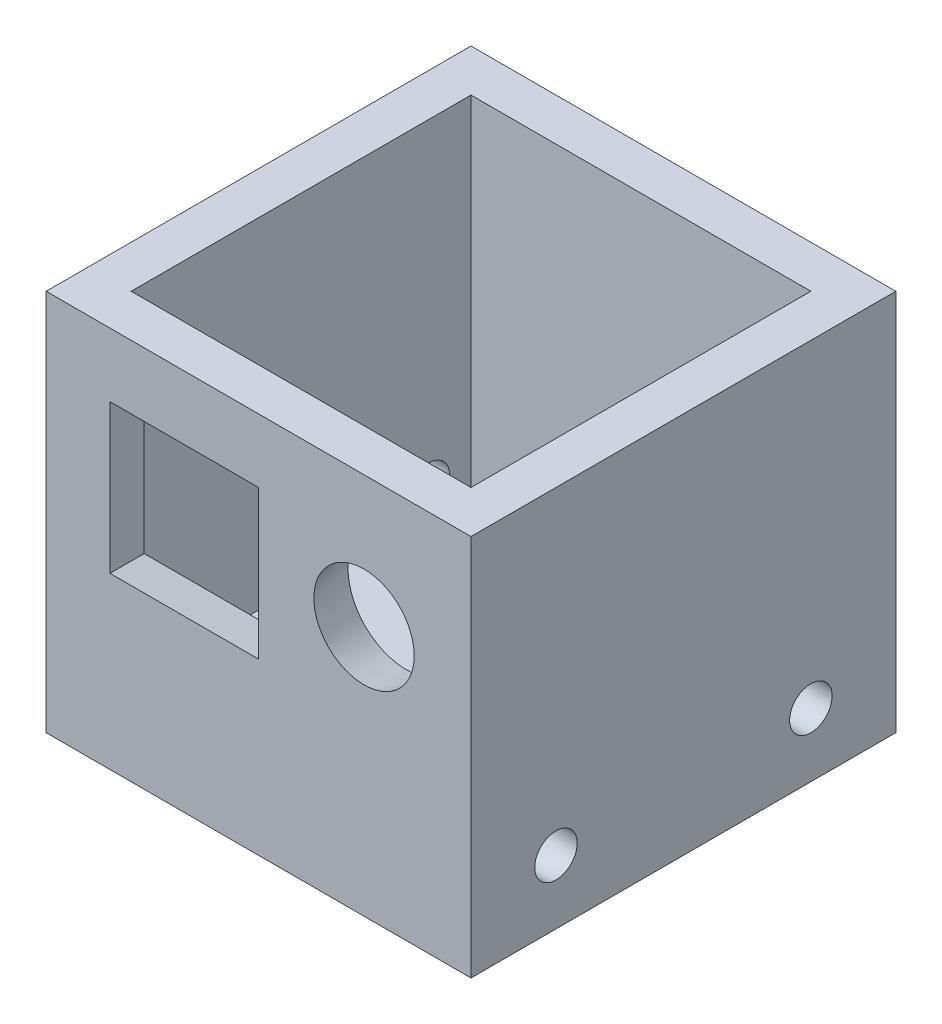
from build123d import *

# Parameters (mm, degrees)
ESQUISSE1_W                       = 10
ESQUISSE1_H                       = 10
BOSS_EXTRU_1_DEPTH                = 9
ESQUISSE3_R                       = 1.18058501
ENL_V_MAT_EXTRU_3_DEPTH           = 1.25
ENL_V_MAT_EXTRU_3_DRAFT           = 11
ESQUISSE3_W                       = 3.5
ESQUISSE3_H                       = 3.5
ENL_V_MAT_EXTRU_3_PROFILE_2_DEPTH = 1.25
ENL_V_MAT_EXTRU_3_PROFILE_2_DRAFT = 11
ESQUISSE5_W                       = 8
ESQUISSE5_H                       = 8
ENL_V_MAT_EXTRU_4_DEPTH           = 8
ESQUISSE7_R                       = 0.5
ENL_V_MAT_EXTRU_5_DEPTH           = 17.763054614


with BuildPart() as part:
    # Esquisse1 → Boss.-Extru.1 (new body)
    with BuildSketch(Plane(origin=(0, 0, 0), x_dir=(1, 0, 0), z_dir=(0, 1, 0))):
        with Locations((5, 5)):
            Rectangle(ESQUISSE1_W, ESQUISSE1_H)
    extrude(amount=BOSS_EXTRU_1_DEPTH)


with BuildPart() as enl_v_mat_extru_3_tool:
    # Esquisse3 → Enlèv. mat.-Extru.3 (with draft: the straight prism first)
    with BuildSketch(Plane.XY):
        with Locations((7.481483156, 5.897810635)):
            Circle(ESQUISSE3_R)
    extrude(amount=-ENL_V_MAT_EXTRU_3_DEPTH)
    # Enlèv. mat.-Extru.3: the draft: its side faces are tilted about the plane it starts from
    enl_v_mat_extru_3_sides = [enl_v_mat_extru_3_tool.faces().sort_by_distance(p)[0] for p in [
        (6.300898146, 5.897810635, -0.625),
    ]]
    draft(enl_v_mat_extru_3_sides, Plane.XY, ENL_V_MAT_EXTRU_3_DRAFT)


with BuildPart() as part_1:
    add(part.part)

    # Enlèv. mat.-Extru.3: cut by enl_v_mat_extru_3_tool
    add(enl_v_mat_extru_3_tool.part, mode=Mode.SUBTRACT)


with BuildPart() as enl_v_mat_extru_3_profile_2_tool:
    # Esquisse3 → Enlèv. mat.-Extru.3 profile 2 (with draft: the straight prism first)
    with BuildSketch(Plane.XY):
        with Locations((3.25, 5.75)):
            Rectangle(ESQUISSE3_W, ESQUISSE3_H)
    extrude(amount=-ENL_V_MAT_EXTRU_3_PROFILE_2_DEPTH)
    # Enlèv. mat.-Extru.3 profile 2: the draft: its side faces are tilted about the plane it starts from
    enl_v_mat_extru_3_profile_2_sides = [enl_v_mat_extru_3_profile_2_tool.faces().sort_by_distance(p)[0] for p in [
        (1.5, 5.75, -0.625),
        (3.25, 4, -0.625),
        (5, 5.75, -0.625),
        (3.25, 7.5, -0.625),
    ]]
    draft(enl_v_mat_extru_3_profile_2_sides, Plane.XY, ENL_V_MAT_EXTRU_3_PROFILE_2_DRAFT)


with BuildPart() as part_2:
    add(part_1.part)

    # Enlèv. mat.-Extru.3 profile 2: cut by enl_v_mat_extru_3_profile_2_tool
    add(enl_v_mat_extru_3_profile_2_tool.part, mode=Mode.SUBTRACT)

    # Esquisse5 → Enlèv. mat.-Extru.4 (cut)
    with BuildSketch(Plane(origin=(0, 9, 0), x_dir=(1, 0, 0), z_dir=(0, 1, 0))):
        with Locations((5, 5)):
            Rectangle(ESQUISSE5_W, ESQUISSE5_H)
    extrude(amount=-ENL_V_MAT_EXTRU_4_DEPTH, mode=Mode.SUBTRACT)

    # Esquisse7 → Enlèv. mat.-Extru.5 (cut, through all)
    with BuildSketch(Plane(origin=(10, 0, 0), x_dir=(0, 0, -1), z_dir=(1, 0, 0))):
        with Locations((2, 1.5)):
            Circle(ESQUISSE7_R)
        with Locations((8, 1.5)):
            Circle(ESQUISSE7_R)
    extrude(amount=-ENL_V_MAT_EXTRU_5_DEPTH, mode=Mode.SUBTRACT)


solid = part_2.part
